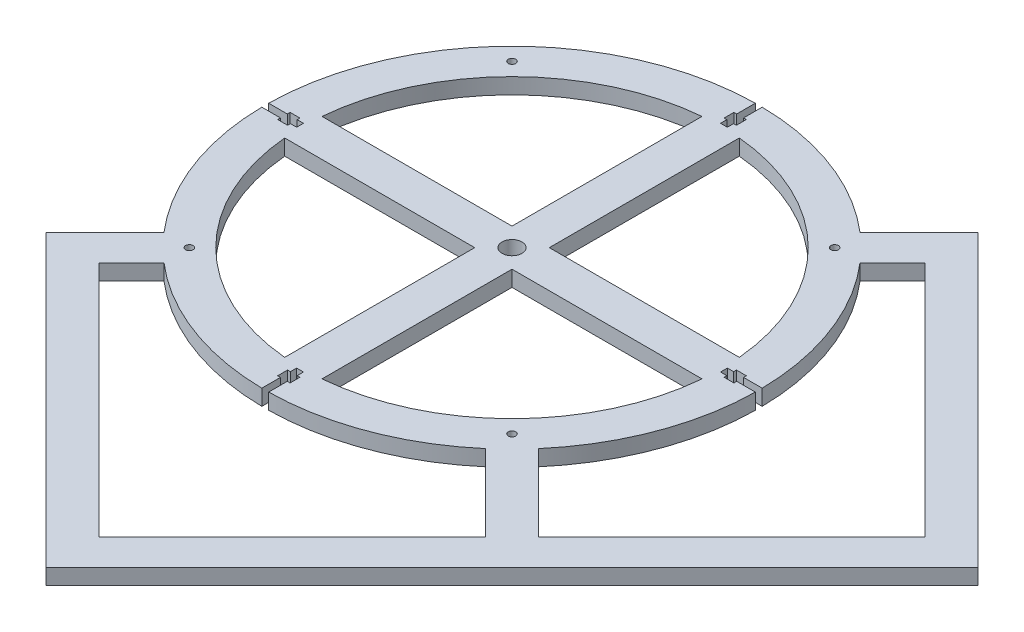
from build123d import *

# Parameters (mm, degrees)
BOSS_EXTRUDE1_DEPTH          = 3.175
SKETCH2_W                    = 2.75
SKETCH2_H                    = 2.5
SKETCH2_H_2                  = 4
SKETCH2_W_2                  = 1.125
SKETCH2_H_3                  = 7.5
CUT_EXTRUDE1_DEPTH           = 291.017379867
CIRPATTERN1_COUNT            = 4
F_3_0_3_DIAMETER_HOLE1_D     = 3
F_8_0_8_DIAMETER_HOLE1_D     = 8
F_8_0_8_DIAMETER_HOLE1_DEPTH = 6.35


with BuildPart() as part:
    # Sketch1 → Boss-Extrude1 (new, symmetric)
    with BuildSketch(Plane(origin=(0, 0, 0), x_dir=(1, 0, 0), z_dir=(0, 1, 0))):
        with BuildLine():
            Line((88.388347648, 98.994949366), (64.667874078, 75.274475795))
            ThreePointArc((64.667874078, 75.274475795), (-70.171862751, 70.171862751), (-75.274475795, -64.667874078))
            Line((-75.274475795, -64.667874078), (-98.994949366, -88.388347648))
            Line((-98.994949366, -88.388347648), (17.67766953, -205.060966544))
            Line((17.67766953, -205.060966544), (205.060966544, -17.67766953))
            Line((205.060966544, -17.67766953), (88.388347648, 98.994949366))
        make_face()
        with BuildLine():
            ThreePointArc((-64.667874078, -75.274475795), (0, -99.238), (64.667874078, -75.274475795))
            Line((64.667874078, -75.274475795), (95.45941546, -106.066017178))
            Line((95.45941546, -106.066017178), (17.67766953, -183.847763109))
            Line((17.67766953, -183.847763109), (-77.781745931, -88.388347648))
            Line((-77.781745931, -88.388347648), (-64.667874078, -75.274475795))
        make_face(mode=Mode.SUBTRACT)
        with BuildLine():
            ThreePointArc((75.274475795, -64.667874078), (99.238, 0), (75.274475795, 64.667874078))
            Line((75.274475795, 64.667874078), (88.388347648, 77.781745931))
            Line((88.388347648, 77.781745931), (183.847763109, -17.67766953))
            Line((183.847763109, -17.67766953), (106.066017178, -95.45941546))
            Line((106.066017178, -95.45941546), (75.274475795, -64.667874078))
        make_face(mode=Mode.SUBTRACT)
        with BuildLine():
            Line((-7.5, -7.5), (-7.5, -83.903460262))
            ThreePointArc((-7.5, -83.903460262), (-59.565261034, -59.565261034), (-83.903460262, -7.5))
            Line((-83.903460262, -7.5), (-7.5, -7.5))
        make_face(mode=Mode.SUBTRACT)
        with BuildLine():
            ThreePointArc((83.903460262, -7.5), (59.565261034, -59.565261034), (7.5, -83.903460262))
            Line((7.5, -83.903460262), (7.5, -7.5))
            Line((7.5, -7.5), (83.903460262, -7.5))
        make_face(mode=Mode.SUBTRACT)
        with BuildLine():
            Line((-7.5, 7.5), (-83.903460262, 7.5))
            ThreePointArc((-83.903460262, 7.5), (-59.565261034, 59.565261034), (-7.5, 83.903460262))
            Line((-7.5, 83.903460262), (-7.5, 7.5))
        make_face(mode=Mode.SUBTRACT)
        with BuildLine():
            ThreePointArc((7.5, 83.903460262), (59.565261034, 59.565261034), (83.903460262, 7.5))
            Line((83.903460262, 7.5), (7.5, 7.5))
            Line((7.5, 7.5), (7.5, 83.903460262))
        make_face(mode=Mode.SUBTRACT)
    extrude(amount=BOSS_EXTRUDE1_DEPTH, both=True)

    # Sketch2 → Cut-Extrude1 (cut, symmetric)
    with BuildSketch(Plane(origin=(0, 0, 0), x_dir=(1, 0, 0), z_dir=(0, 1, 0))):
        with Locations((0, 86.488)):
            Rectangle(SKETCH2_W, SKETCH2_H)
        with Locations((0, 89.738)):
            Rectangle(SKETCH2_W, SKETCH2_H_2)
        with Locations((1.9375, 89.738)):
            Rectangle(SKETCH2_W_2, SKETCH2_H_2)
        with Locations((0, 95.488)):
            Rectangle(SKETCH2_W, SKETCH2_H_3)
        with Locations((-1.9375, 89.738)):
            Rectangle(SKETCH2_W_2, SKETCH2_H_2)
    cut_extrude1 = extrude(amount=CUT_EXTRUDE1_DEPTH, both=True, mode=Mode.SUBTRACT)

    # CirPattern1: Cut-Extrude1 ×4 about axis
    cirpattern1_axis = Axis((0, 0, 0), (0, 1, 0))
    for i in range(1, CIRPATTERN1_COUNT):
        add(cut_extrude1.rotate(cirpattern1_axis, i * 360 / CIRPATTERN1_COUNT), mode=Mode.SUBTRACT)

    # Ø3.0 (3) Diameter Hole1 (through all)
    with Locations(Plane(origin=(0, 3.175, 0), x_dir=(1, 0, 0), z_dir=(0, 1, 0))):
        with Locations((-64.868561892, -64.868561892), (0, 0), (-64.868561892, 64.868561892), (64.868561892, 64.868561892), (64.868561892, -64.868561892)):
            Hole(F_3_0_3_DIAMETER_HOLE1_D / 2)

    # Ø8.0 (8) Diameter Hole1
    with Locations(Plane(origin=(0, 3.175, 0), x_dir=(1, 0, 0), z_dir=(0, 1, 0))):
        with Locations((0, 0)):
            Hole(F_8_0_8_DIAMETER_HOLE1_D / 2, depth=F_8_0_8_DIAMETER_HOLE1_DEPTH)


solid = part.part
